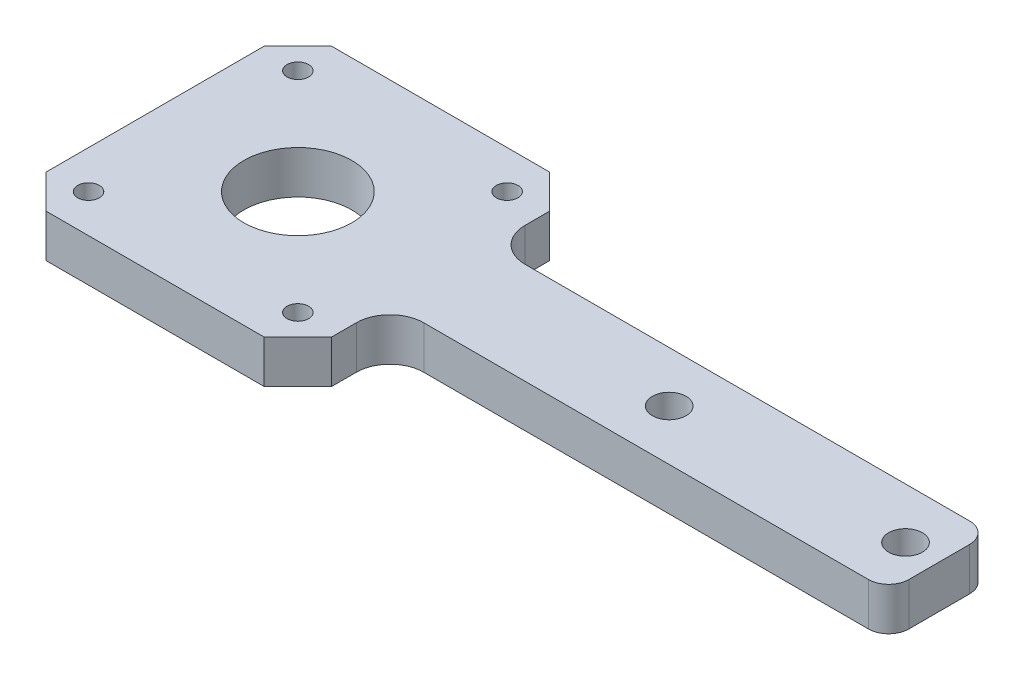
from build123d import *

# Parameters (mm, degrees)
SKETCH1_R           = 1.6
SKETCH1_R_2         = 8
SKETCH1_R_3         = 2.5
BOSS_EXTRUDE2_DEPTH = 6.35
CHAMFER2_SIZE       = 5
FILLET1_R           = 3
FILLET2_R           = 5


with BuildPart() as part:
    # Sketch1 → Boss-Extrude2 (new body)
    with BuildSketch(Plane(origin=(0, 0, 0), x_dir=(1, 0, 0), z_dir=(0, 1, 0))):
        Polygon((-21.15, 21.15), (21.15, 21.15), (21.15, 7.5), (95, 7.5), (95, -7.5), (21.15, -7.5), (21.15, -21.15), (-21.15, -21.15), align=None)
        with Locations(Location((-15.5, 15.5, 0), (0, 0, 270))):
            Circle(SKETCH1_R, mode=Mode.SUBTRACT)
        with Locations(Location((15.5, 15.5, 0), (0, 0, 270))):
            Circle(SKETCH1_R, mode=Mode.SUBTRACT)
        with Locations(Location((15.5, -15.5, 0), (0, 0, 270))):
            Circle(SKETCH1_R, mode=Mode.SUBTRACT)
        with Locations(Location((-15.5, -15.5, 0), (0, 0, 270))):
            Circle(SKETCH1_R, mode=Mode.SUBTRACT)
        with Locations(Location((0, 0, 0), (0, 0, 270))):
            Circle(SKETCH1_R_2, mode=Mode.SUBTRACT)
        with Locations(Location((90, 0, 0), (0, 0, 270))):
            Circle(SKETCH1_R_3, mode=Mode.SUBTRACT)
        with Locations(Location((55, 0, 0), (0, 0, 270))):
            Circle(SKETCH1_R_3, mode=Mode.SUBTRACT)
    extrude(amount=BOSS_EXTRUDE2_DEPTH)

    # Chamfer2
    chamfer2_edges = [part.edges().sort_by_distance(p)[0] for p in [
        (21.15, 3.175, 21.15),
        (-21.15, 3.175, 21.15),
        (-21.15, 3.175, -21.15),
        (21.15, 3.175, -21.15),
    ]]
    chamfer(chamfer2_edges, length=CHAMFER2_SIZE)

    # Fillet1
    fillet1_edges = [part.edges().sort_by_distance(p)[0] for p in [
        (95, 3.175, -7.5),
        (95, 3.175, 7.5),
    ]]
    fillet(fillet1_edges, radius=FILLET1_R)

    # Fillet2
    fillet2_edges = [part.edges().sort_by_distance(p)[0] for p in [
        (21.15, 3.175, -7.5),
        (21.15, 3.175, 7.5),
    ]]
    fillet(fillet2_edges, radius=FILLET2_R)


solid = part.part
